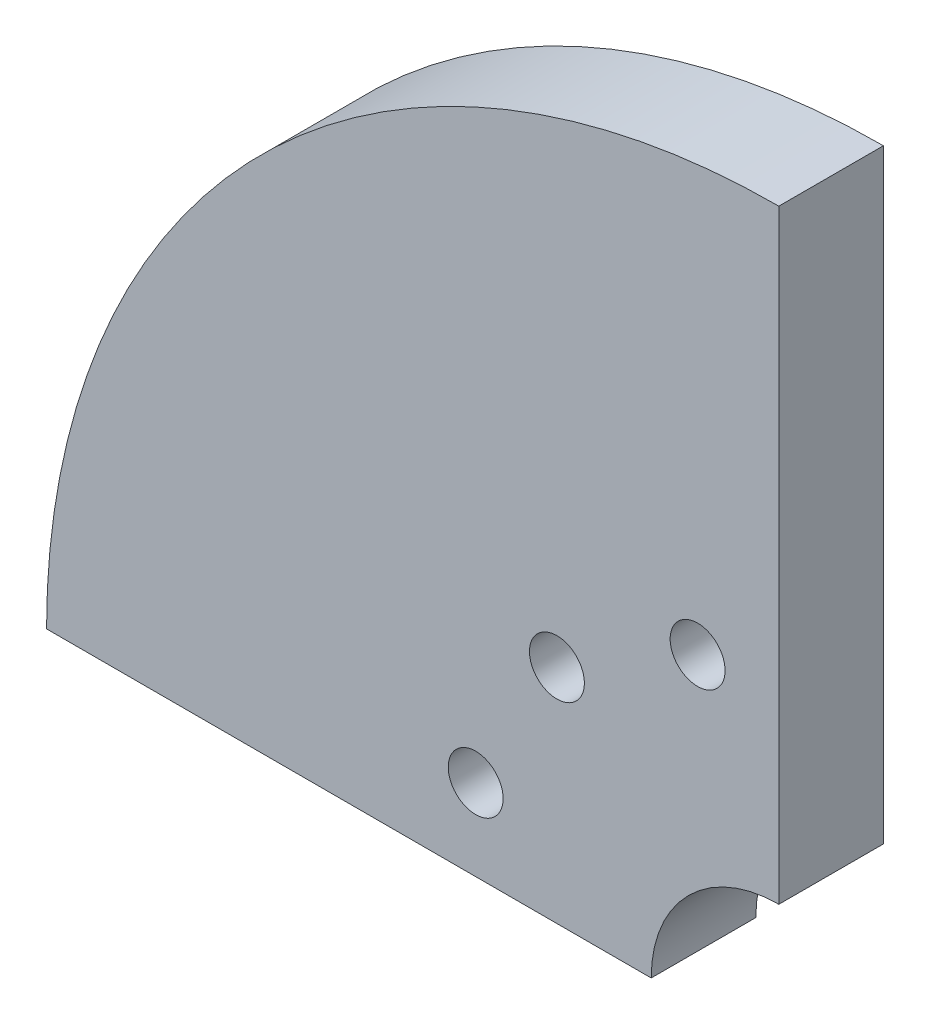
from build123d import *

# Parameters (mm, degrees)
BOSS_EXTRUDE1_DEPTH = 10
SKETCH2_R           = 2.625
CUT_EXTRUDE1_DEPTH  = 100.49874371
SKETCH3_R           = 12.2
CUT_EXTRUDE2_DEPTH  = 20
CUT_EXTRUDE3_DEPTH  = 4


with BuildPart() as part:
    # Sketch1 → Boss-Extrude1 (new body)
    with BuildSketch(Plane.XY):
        with BuildLine():
            Line((0, 70), (0, 0))
            Line((0, 0), (-70, 0))
            ThreePointArc((-70, 0), (-49.497474683, 49.497474683), (0, 70))
        make_face()
    extrude(amount=BOSS_EXTRUDE1_DEPTH)

    # Sketch2 → Cut-Extrude1 (cut, through all)
    with BuildSketch(Plane.XY):
        with Locations((-7.76457135, 28.97777479)):
            Circle(SKETCH2_R)
        with Locations((-21.213203434, 21.213203438)):
            Circle(SKETCH2_R)
        with Locations((-28.977774788, 7.764571356)):
            Circle(SKETCH2_R)
    extrude(amount=CUT_EXTRUDE1_DEPTH, mode=Mode.SUBTRACT)

    # Sketch3 → Cut-Extrude2 (cut)
    with BuildSketch(Plane.XY):
        Circle(SKETCH3_R)
    extrude(amount=CUT_EXTRUDE2_DEPTH, mode=Mode.SUBTRACT)

    # Sketch4 → Cut-Extrude3 (cut)
    with BuildSketch(Plane.XY):
        Polygon((-20.139437084, 31.464597344), (-35.69578627, 47.02094653), (-47.009494769, 35.707238031), (-31.453145583, 20.150888845), align=None)
        Polygon((-1.708965461, 37.318859162), (-17.163778681, 33.17775444), (-22.857797674, 54.428122618), (-7.402984453, 58.56922734), align=None)
        Polygon((-33.173562805, 17.179422078), (-54.423930983, 22.87344107), (-58.565035705, 7.418627849), (-37.314667526, 1.724608857), align=None)
    extrude(amount=CUT_EXTRUDE3_DEPTH, mode=Mode.SUBTRACT)


solid = part.part
